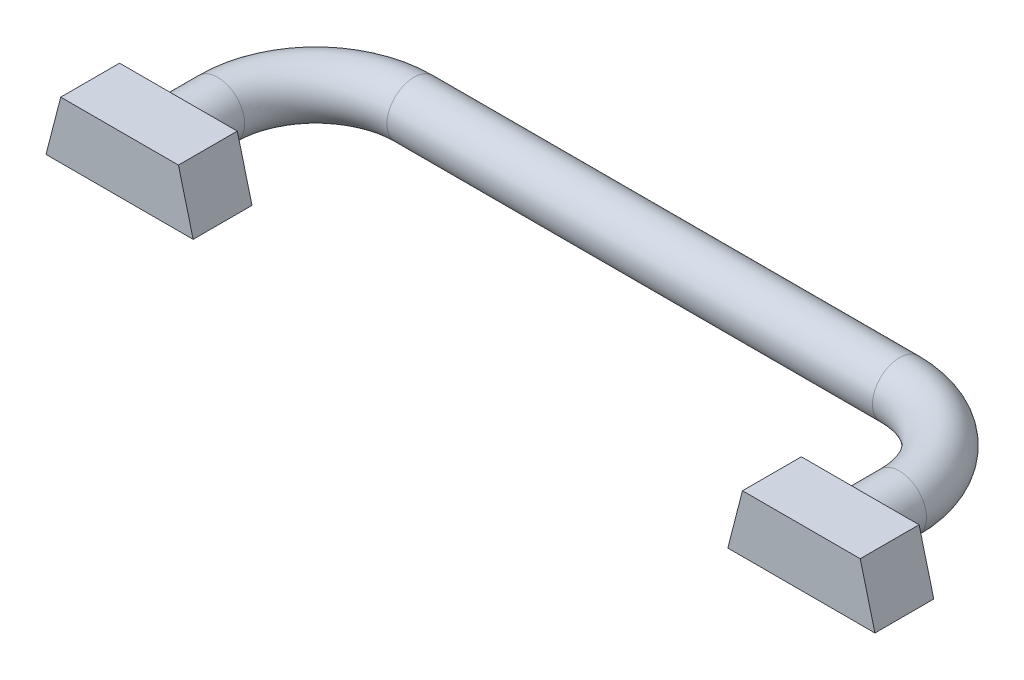
from build123d import *

# Parameters (mm, degrees)
SKETCH_2_R      = 2.75
EXTRUDE_1_DEPTH = 6
EXTRUDE_2_DEPTH = 6


with BuildPart() as part:
    # По траектории1: sweep along a path in Эскиз1
    with BuildLine(Plane(origin=(0, 0, 0), x_dir=(1, 0, 0), z_dir=(0, 1, 0))) as sweep_1_path:
        Line((0, 0), (0, 10))
        ThreePointArc((0, 10), (2.928932188, 17.071067812), (10, 20))
        Line((10, 20), (59.5, 20))
        ThreePointArc((59.5, 20), (66.571067812, 17.071067812), (69.5, 10))
        Line((69.5, 10), (69.5, 0))
    # Эскиз2 → По траектории1 (sweep)
    with BuildSketch(Plane.XY):
        Circle(SKETCH_2_R)
    sweep(path=sweep_1_path.line)

    # Эскиз3 → Бобышка-Вытянуть1 (add)
    with BuildSketch(Plane.XY):
        Polygon((-6, 3), (6, 3), (7.5, -2.809475019), (-7.5, -2.809475019), align=None)
    extrude(amount=-EXTRUDE_1_DEPTH)

    # Эскиз4 → Бобышка-Вытянуть2 (add)
    with BuildSketch(Plane.XY):
        Polygon((63.5, 3), (75.5, 3), (77, -2.809475019), (62, -2.809475019), align=None)
    extrude(amount=-EXTRUDE_2_DEPTH)


solid = part.part
